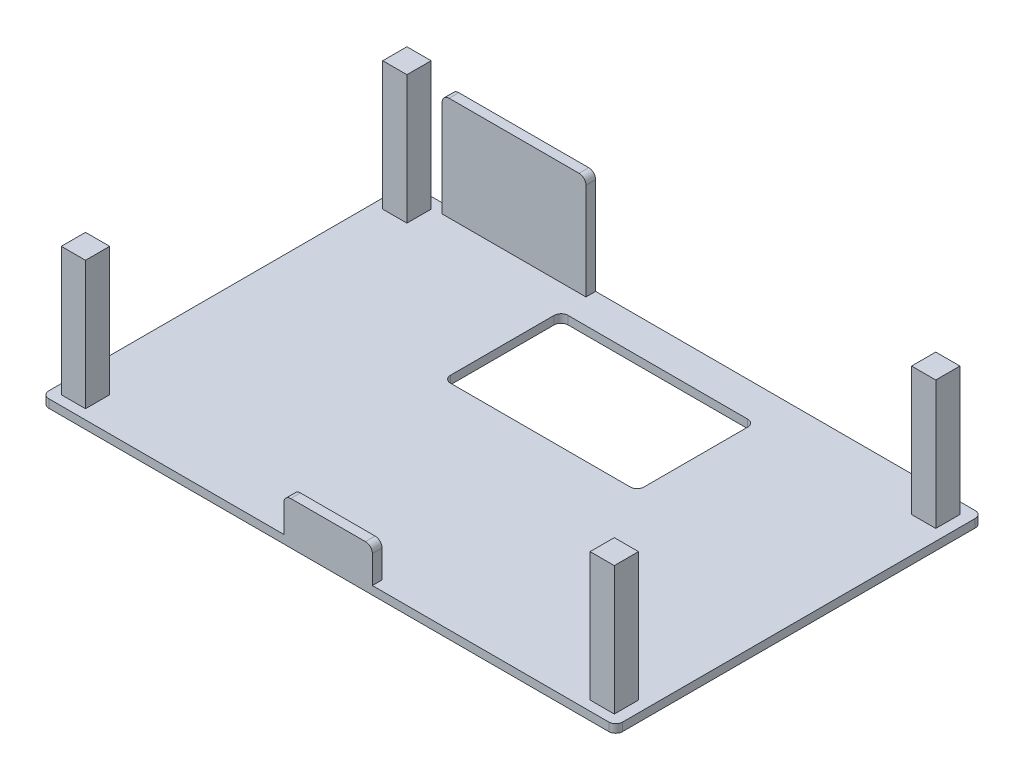
from build123d import *

# Parameters (mm, degrees)
SKETCH_1_W          = 83
SKETCH_1_H          = 53
EXTRUDE_1_DEPTH     = 1.2
SKETCH_1_4_W        = 3.5
SKETCH_1_4_H        = 3.5
EXTRUDE_2_DEPTH     = 19.8
EXTRUDE_3_DEPTH     = 1.2
SKETCH_3_W          = 20.8
SKETCH_3_H          = 1.4
EXTRUDE_4_DEPTH     = 15
SKETCH_4_W          = 12.8
SKETCH_4_H          = 1.4
EXTRUDE_5_DEPTH     = 5
SKETCH_5_W          = 28
SKETCH_5_H          = 17
CUT_EXTRUDE_1_DEPTH = 5
FILLET_2_R          = 1
FILLET_3_R          = 1
FILLET_4_R          = 1


with BuildPart() as part:
    # 草图1 → 凸台-拉伸1 (new body)
    with BuildSketch(Plane(origin=(0, 0, 0), x_dir=(1, 0, 0), z_dir=(0, 1, 0))):
        with Locations((40.1, 25.1)):
            Rectangle(SKETCH_1_W, SKETCH_1_H)
        Polygon((3.5, 0), (0, 0), (0, 3.5), (0, 46.5), (0, 50), (3.5, 50), (76.5, 50), (80, 50), (80, 46.5), (80, 3.5), (80, 0), (76.5, 0), align=None, mode=Mode.SUBTRACT)
    extrude(amount=EXTRUDE_1_DEPTH)

    # 草图1<4> → 凸台-拉伸2 (add)
    with BuildSketch(Plane(origin=(0, 0, 0), x_dir=(1, 0, 0), z_dir=(0, 1, 0))):
        with Locations((1.75, 1.75)):
            Rectangle(SKETCH_1_4_W, SKETCH_1_4_H)
        with Locations((78.25, 1.75)):
            Rectangle(SKETCH_1_4_W, SKETCH_1_4_H)
        with Locations((1.75, 48.25)):
            Rectangle(SKETCH_1_4_W, SKETCH_1_4_H)
        with Locations((78.25, 48.25)):
            Rectangle(SKETCH_1_4_W, SKETCH_1_4_H)
    extrude(amount=EXTRUDE_2_DEPTH)

    # 草图1<5> → 凸台-拉伸3 (add)
    with BuildSketch(Plane(origin=(0, 0, 0), x_dir=(1, 0, 0), z_dir=(0, 1, 0))):
        Polygon((3.5, 3.5), (3.5, 0), (76.5, 0), (76.5, 3.5), (80, 3.5), (80, 46.5), (76.5, 46.5), (76.5, 50), (3.5, 50), (3.5, 46.5), (0, 46.5), (0, 3.5), align=None)
    extrude(amount=EXTRUDE_3_DEPTH)

    # 草图3 → 凸台-拉伸4 (add)
    with BuildSketch(Plane(origin=(0, 1.2, 0), x_dir=(1, 0, 0), z_dir=(0, 1, 0))):
        with Locations((15.3, 50.9)):
            Rectangle(SKETCH_3_W, SKETCH_3_H)
    extrude(amount=EXTRUDE_4_DEPTH)

    # 草图4 → 凸台-拉伸5 (add)
    with BuildSketch(Plane(origin=(0, 1.2, 0), x_dir=(1, 0, 0), z_dir=(0, 1, 0))):
        with Locations((40, -0.7)):
            Rectangle(SKETCH_4_W, SKETCH_4_H)
    extrude(amount=EXTRUDE_5_DEPTH)

    # 草图5 → 切除-拉伸1 (cut)
    with BuildSketch(Plane(origin=(0, 1.2, 0), x_dir=(1, 0, 0), z_dir=(0, 1, 0))):
        with Locations((39.7, 38.1)):
            Rectangle(SKETCH_5_W, SKETCH_5_H)
    extrude(amount=-CUT_EXTRUDE_1_DEPTH, mode=Mode.SUBTRACT)

    # 圆角2
    fillet_2_edges = [part.edges().sort_by_distance(p)[0] for p in [
        (81.6, 0.6, -51.6),
        (81.6, 0.6, 1.4),
        (-1.4, 0.6, -51.6),
        (-1.4, 0.6, 1.4),
        (53.7, 0.6, -29.6),
        (25.7, 0.6, -29.6),
        (25.7, 0.6, -46.6),
        (53.7, 0.6, -46.6),
    ]]
    fillet(fillet_2_edges, radius=FILLET_2_R)

    # 圆角3
    fillet_3_edges = [part.edges().sort_by_distance(p)[0] for p in [
        (4.9, 16.2, -50.9),
        (25.7, 16.2, -50.9),
    ]]
    fillet(fillet_3_edges, radius=FILLET_3_R)

    # 圆角4
    fillet_4_edges = [part.edges().sort_by_distance(p)[0] for p in [
        (46.4, 6.2, 0.7),
        (33.6, 6.2, 0.7),
    ]]
    fillet(fillet_4_edges, radius=FILLET_4_R)


solid = part.part
